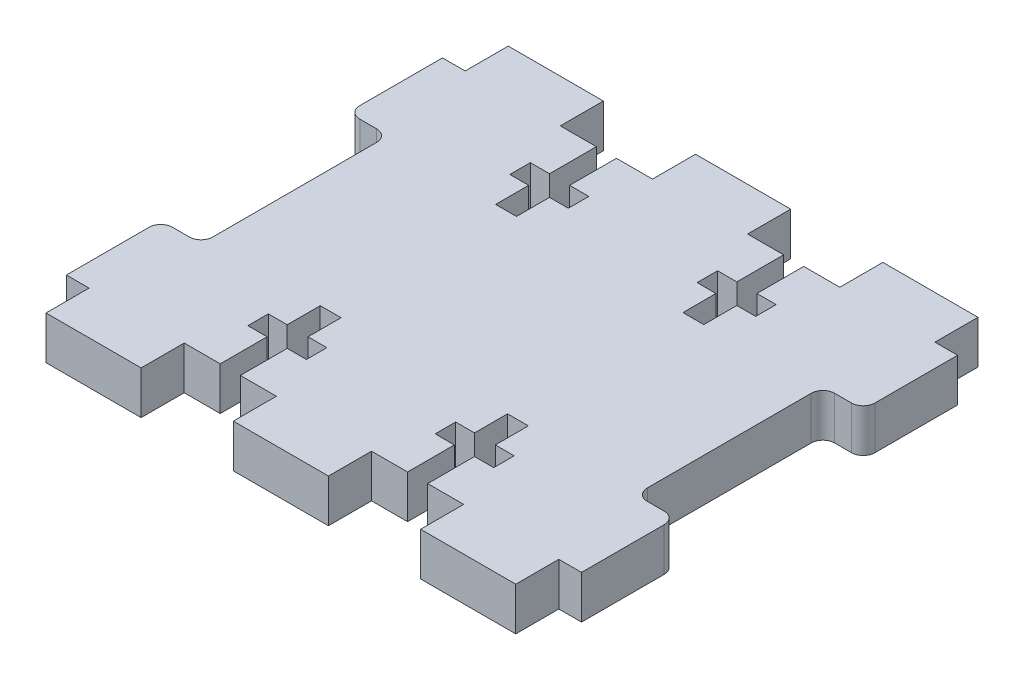
from build123d import *

# Parameters (mm, degrees)
BOSS_EXTRUDE1_DEPTH = 5.842
SKETCH2_W           = 5.460302537
SKETCH2_H           = 25.4
CUT_EXTRUDE1_DEPTH  = 48.288535112
FILLET2_R           = 1.5875


with BuildPart() as part:
    # Sketch1 → Boss-Extrude1 (new body)
    with BuildSketch(Plane(origin=(0, 0, 0), x_dir=(1, 0, 0), z_dir=(0, 1, 0))):
        Polygon((-6.45, 31.342), (-6.45, 25.5), (-11.335313542, 25.5), (-11.335313542, 19.15), (-8.73125, 19.15), (-8.73125, 16.371875), (-11.286067573, 16.371875), (-11.286067573, 11.892), (-14.113932427, 11.892), (-14.113932427, 16.371875), (-16.66875, 16.371875), (-16.66875, 19.15), (-14.064686458, 19.15), (-14.064686458, 25.5), (-18.95, 25.5), (-18.95, 31.342), (-31.85, 31.342), (-31.85, 25.5), (-34.925, 25.5), (-34.925, -25.5), (-31.85, -25.5), (-31.85, -31.342), (-18.95, -31.342), (-18.95, -25.5), (-14.064686458, -25.5), (-14.064686458, -19.15), (-16.66875, -19.15), (-16.66875, -16.371875), (-14.113932427, -16.371875), (-14.113932427, -11.892), (-11.286067573, -11.892), (-11.286067573, -16.371875), (-8.73125, -16.371875), (-8.73125, -19.15), (-11.335313542, -19.15), (-11.335313542, -25.5), (-6.45, -25.5), (-6.45, -31.342), (6.45, -31.342), (6.45, -25.5), (11.335313542, -25.5), (11.335313542, -19.15), (8.73125, -19.15), (8.73125, -16.371875), (11.286067573, -16.371875), (11.286067573, -11.892), (14.113932427, -11.892), (14.113932427, -16.371875), (16.66875, -16.371875), (16.66875, -19.15), (14.064686458, -19.15), (14.064686458, -25.5), (18.95, -25.5), (18.95, -31.342), (31.85, -31.342), (31.85, -25.5), (34.925, -25.5), (34.925, 25.5), (31.85, 25.5), (31.85, 31.342), (18.95, 31.342), (18.95, 25.5), (14.064686458, 25.5), (14.064686458, 19.15), (16.66875, 19.15), (16.66875, 16.371875), (14.113932427, 16.371875), (14.113932427, 11.892), (11.286067573, 11.892), (11.286067573, 16.371875), (8.73125, 16.371875), (8.73125, 19.15), (11.335313542, 19.15), (11.335313542, 25.5), (6.45, 25.5), (6.45, 31.342), align=None)
    extrude(amount=BOSS_EXTRUDE1_DEPTH)

    # Sketch2 → Cut-Extrude1 (cut, through all)
    with BuildSketch(Plane(origin=(0, 5.842, 0), x_dir=(1, 0, 0), z_dir=(0, 1, 0))):
        with Locations((-32.194848732, 0)):
            Rectangle(SKETCH2_W, SKETCH2_H)
        with Locations((32.194848732, 0)):
            Rectangle(SKETCH2_W, SKETCH2_H)
    extrude(amount=-CUT_EXTRUDE1_DEPTH, mode=Mode.SUBTRACT)

    # Fillet2
    fillet2_edges = [part.edges().sort_by_distance(p)[0] for p in [
        (-34.925, 2.921, -12.7),
        (-29.464697463, 2.921, -12.7),
        (-29.464697463, 2.921, 12.7),
        (-34.925, 2.921, 12.7),
        (29.464697463, 2.921, -12.7),
        (34.925, 2.921, -12.7),
        (34.925, 2.921, 12.7),
        (29.464697463, 2.921, 12.7),
    ]]
    fillet(fillet2_edges, radius=FILLET2_R)


solid = part.part
